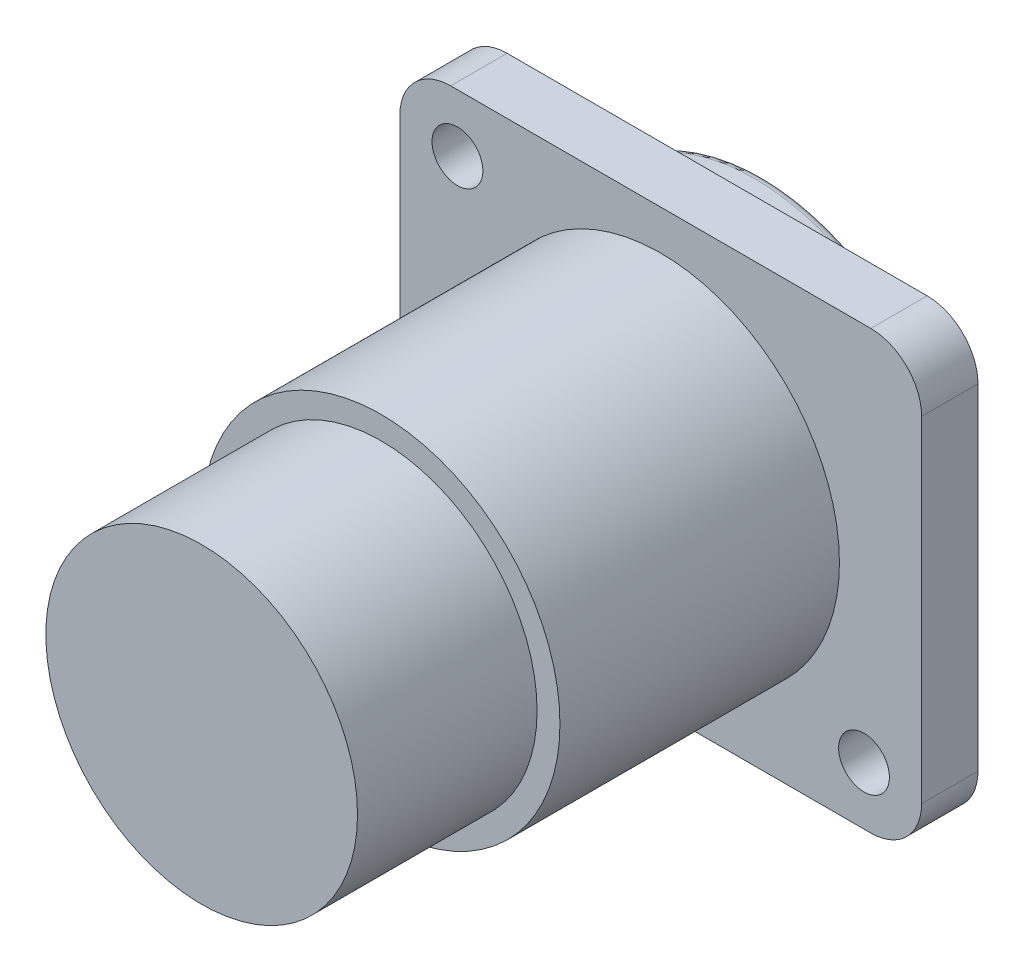
from build123d import *

# Parameters (mm, degrees)
SZKIC1_R                    = 11.6
DODANIE_WYCI_GNI_CIE1_DEPTH = 2.7
ZAOKR_GLENIE1_R             = 0.5
SZKIC2_W                    = 30.8
SZKIC2_H                    = 25.8
DODANIE_WYCI_GNI_CIE2_DEPTH = 3.33
SZKIC3_R                    = 10.55
DODANIE_WYCI_GNI_CIE3_DEPTH = 16.5
SZKIC4_R                    = 9.2
DODANIE_WYCI_GNI_CIE4_DEPTH = 10.6
SZKIC5_R                    = 1.5
WYTNIJ_WYCI_GNI_CIE1_DEPTH  = 10.6
ZAOKR_GLENIE2_R             = 3


with BuildPart() as part:
    # Szkic1 → Dodanie-wyciągnięcie1 (new body)
    with BuildSketch(Plane.XY):
        with Locations(Location((0, 0, 0), (0, 0, 180))):
            Circle(SZKIC1_R)
    extrude(amount=DODANIE_WYCI_GNI_CIE1_DEPTH)

    # Zaokrąglenie1
    zaokr_glenie1_edges = [part.edges().sort_by_distance(p)[0] for p in [
        (11.6, 0, 0),
    ]]
    fillet(zaokr_glenie1_edges, radius=ZAOKR_GLENIE1_R)

    # Szkic2 → Dodanie-wyciągnięcie2 (add)
    with BuildSketch(Plane.XY.offset(2.7)):
        Rectangle(SZKIC2_W, SZKIC2_H)
    extrude(amount=DODANIE_WYCI_GNI_CIE2_DEPTH)

    # Szkic3 → Dodanie-wyciągnięcie3 (add)
    with BuildSketch(Plane.XY.offset(6.03)):
        Circle(SZKIC3_R)
    extrude(amount=DODANIE_WYCI_GNI_CIE3_DEPTH)

    # Szkic4 → Dodanie-wyciągnięcie4 (add)
    with BuildSketch(Plane.XY.offset(22.53)):
        Circle(SZKIC4_R)
    extrude(amount=DODANIE_WYCI_GNI_CIE4_DEPTH)

    # Szkic5 → Wytnij-wyciągnięcie1 (cut)
    with BuildSketch(Plane(origin=(0, 0, 2.7), x_dir=(-1, 0, 0), z_dir=(0, 0, -1))):
        with Locations((-12, -9.5)):
            Circle(SZKIC5_R)
        with Locations((12, 9.5)):
            Circle(SZKIC5_R)
    extrude(amount=-WYTNIJ_WYCI_GNI_CIE1_DEPTH, mode=Mode.SUBTRACT)

    # Zaokrąglenie2
    zaokr_glenie2_edges = [part.edges().sort_by_distance(p)[0] for p in [
        (-15.4, 12.9, 4.365),
        (-15.4, -12.9, 4.365),
        (15.4, -12.9, 4.365),
        (15.4, 12.9, 4.365),
    ]]
    fillet(zaokr_glenie2_edges, radius=ZAOKR_GLENIE2_R)


solid = part.part
